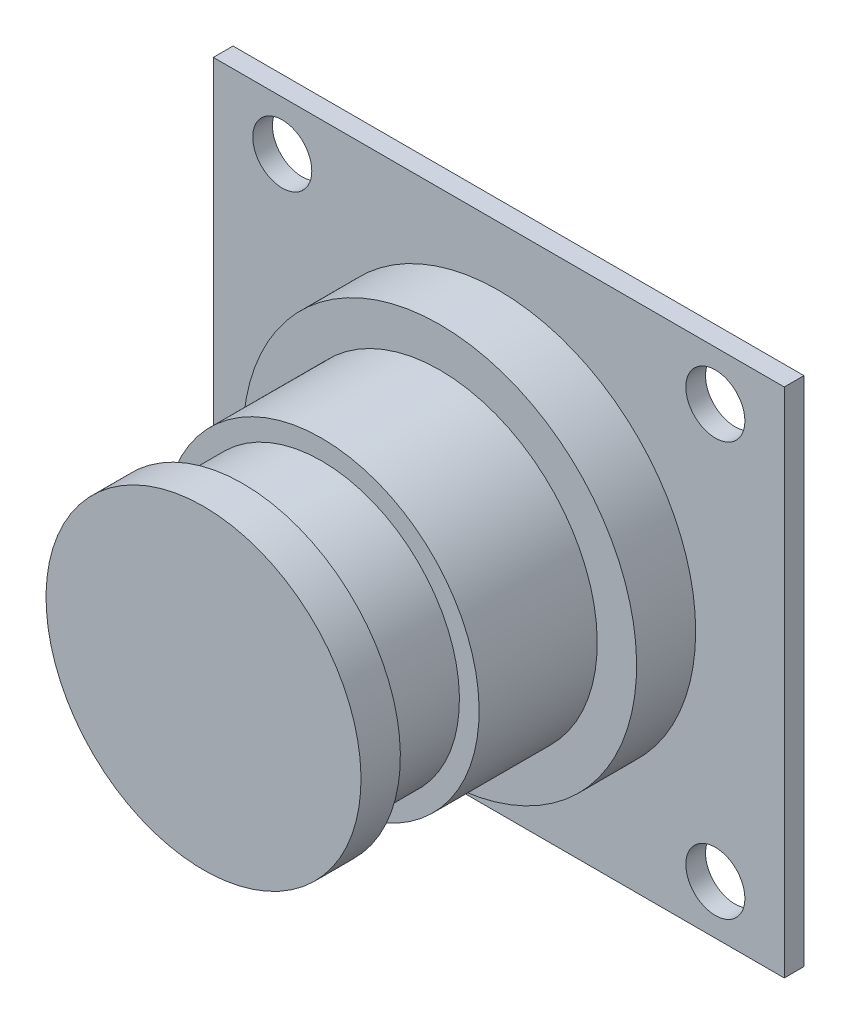
from build123d import *

# Parameters (mm, degrees)
SKETCH_1_W      = 29
SKETCH_1_H      = 26
SKETCH_1_R      = 1.5
EXTRUDE_1_DEPTH = 1


with BuildPart() as part:
    # 草图1 → 凸台-拉伸1 (new body)
    with BuildSketch(Plane.XY):
        Rectangle(SKETCH_1_W, SKETCH_1_H)
        with Locations((-11, 10.5)):
            Circle(SKETCH_1_R, mode=Mode.SUBTRACT)
        with Locations((11, 10.5)):
            Circle(SKETCH_1_R, mode=Mode.SUBTRACT)
        with Locations((11, -10.5)):
            Circle(SKETCH_1_R, mode=Mode.SUBTRACT)
        with Locations((-11, -10.5)):
            Circle(SKETCH_1_R, mode=Mode.SUBTRACT)
    extrude(amount=EXTRUDE_1_DEPTH)

    # 草图2 → 旋转2 (revolve)
    with BuildSketch(Plane(origin=(0, 0, 0), x_dir=(0, 0, -1), z_dir=(1, 0, 0))):
        Polygon((-1, 0), (-16, 0), (-16, 8), (-14, 8), (-14, 7), (-10, 7), (-10, 8), (-4, 8), (-4, 10), (-1, 10), align=None)
    revolve(axis=Axis((0, 0, 1), (0, 0, 1)))


solid = part.part
